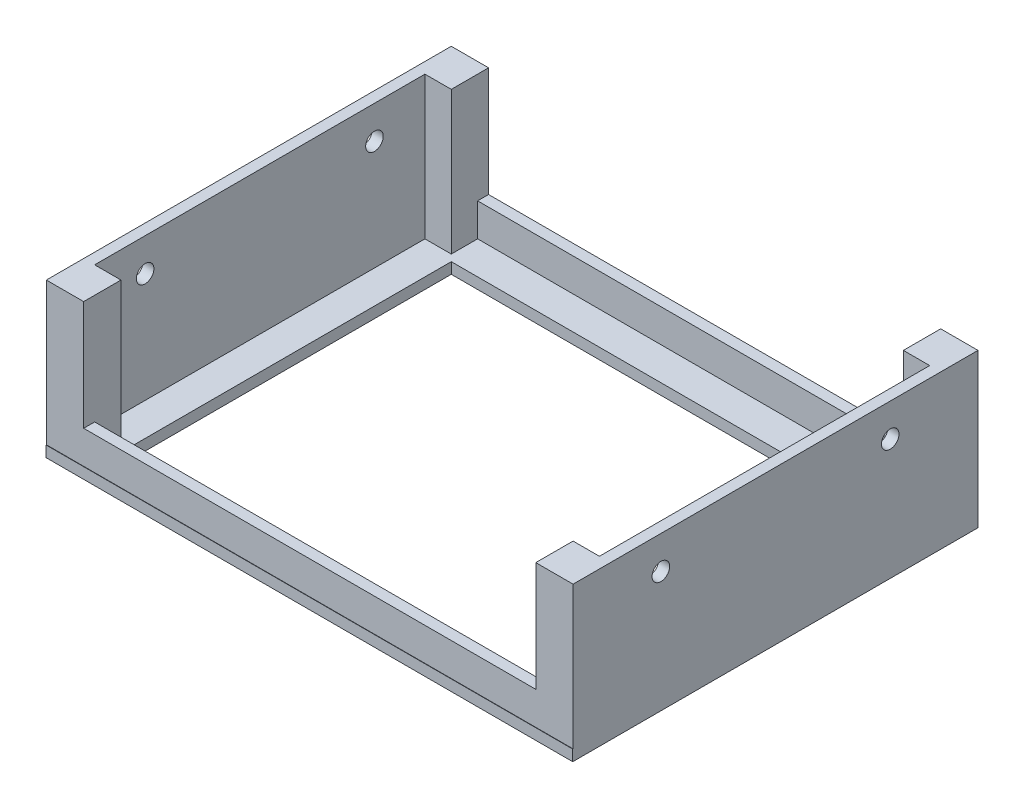
from build123d import *

# Parameters (mm, degrees)
SKIZZE1_W                       = 240
SKIZZE1_H                       = 184.5
AUFSATZ_LINEAR_AUSTRAGEN1_DEPTH = 70
SKIZZE2_W                       = 206
SKIZZE2_H                       = 50
SCHNITT_LINEAR_AUSTRAGEN3_DEPTH = 231.955082213
SKIZZE3_W                       = 240
SKIZZE3_H                       = 184.662178294
SKIZZE3_W_2                     = 200
SKIZZE3_H_2                     = 144.5
AUFSATZ_LINEAR_AUSTRAGEN2_DEPTH = 5
F_8_0MM_STIFTLOCH1_D            = 8


with BuildPart() as part:
    # Skizze1 → Aufsatz-Linear austragen1 (new body)
    with BuildSketch(Plane(origin=(0, 0, 0), x_dir=(1, 0, 0), z_dir=(0, 1, 0))):
        Rectangle(SKIZZE1_W, SKIZZE1_H)
        Polygon((103, 87.25), (-103, 87.25), (-103, 75.25), (-115, 75.25), (-115, -75.25), (-103, -75.25), (-103, -87.25), (103, -87.25), (103, -75.25), (115, -75.25), (115, 75.25), (103, 75.25), align=None, mode=Mode.SUBTRACT)
    extrude(amount=AUFSATZ_LINEAR_AUSTRAGEN1_DEPTH)

    # Skizze2 → Schnitt-Linear austragen3 (cut, through all)
    with BuildSketch(Plane.XY.offset(92.25)):
        with Locations((0, 45)):
            Rectangle(SKIZZE2_W, SKIZZE2_H)
    extrude(amount=-SCHNITT_LINEAR_AUSTRAGEN3_DEPTH, mode=Mode.SUBTRACT)

    # Skizze3 → Aufsatz-Linear austragen2 (add)
    with BuildSketch(Plane(origin=(0, 0, 0), x_dir=(1, 0, 0), z_dir=(0, 1, 0))):
        with Locations((0, -0.081089147)):
            Rectangle(SKIZZE3_W, SKIZZE3_H)
        Rectangle(SKIZZE3_W_2, SKIZZE3_H_2, mode=Mode.SUBTRACT)
    extrude(amount=AUFSATZ_LINEAR_AUSTRAGEN2_DEPTH)

    # Skizze7 → Kernloch für M4x0.71 (revolve, cut)
    with BuildSketch(Plane(origin=(107.5, 0, -79.75), x_dir=(0, 0, -1), z_dir=(1, 0, 0))):
        Polygon((0, 0), (0, 20.991420021), (1.65, 20), (1.65, 0), align=None)
    kernloch_f_r_m4x0_71 = revolve(axis=Axis((107.5, -6.35, -79.75), (0, 1, 0)), mode=Mode.SUBTRACT)

    # Spiegeln1: Kernloch für M4x0.71 across plane
    add(kernloch_f_r_m4x0_71.mirror(Plane.ZY), mode=Mode.SUBTRACT)

    # Spiegeln2: Kernloch für M4x0.71 across plane
    add(kernloch_f_r_m4x0_71.mirror(Plane(origin=(0, 0, 0), x_dir=(1, 0, 0), z_dir=(0, 0, -1))), mode=Mode.SUBTRACT)

    # Spiegeln2 copy 1 sketch → Spiegeln2 copy 1 (revolve, cut)
    with BuildSketch(Plane(origin=(-107.5, 0, 79.75), x_dir=(0, 0, 1), z_dir=(-1, 0, 0))):
        Polygon((0, 0), (0, 20.991420021), (1.65, 20), (1.65, 0), align=None)
    revolve(axis=Axis((-107.5, -6.35, 79.75), (0, 1, 0)), mode=Mode.SUBTRACT)

    # Ø8.0mm Stiftloch1 (through all)
    with Locations(Plane.ZY.offset(120)):
        with Locations((-52.25, 55)):
            f_8_0mm_stiftloch1 = Hole(F_8_0MM_STIFTLOCH1_D / 2)

    # Spiegeln3: Ø8.0mm Stiftloch1 across plane
    add(f_8_0mm_stiftloch1.mirror(Plane(origin=(0, 0, 0), x_dir=(1, 0, 0), z_dir=(0, 0, -1))), mode=Mode.SUBTRACT)


solid = part.part
